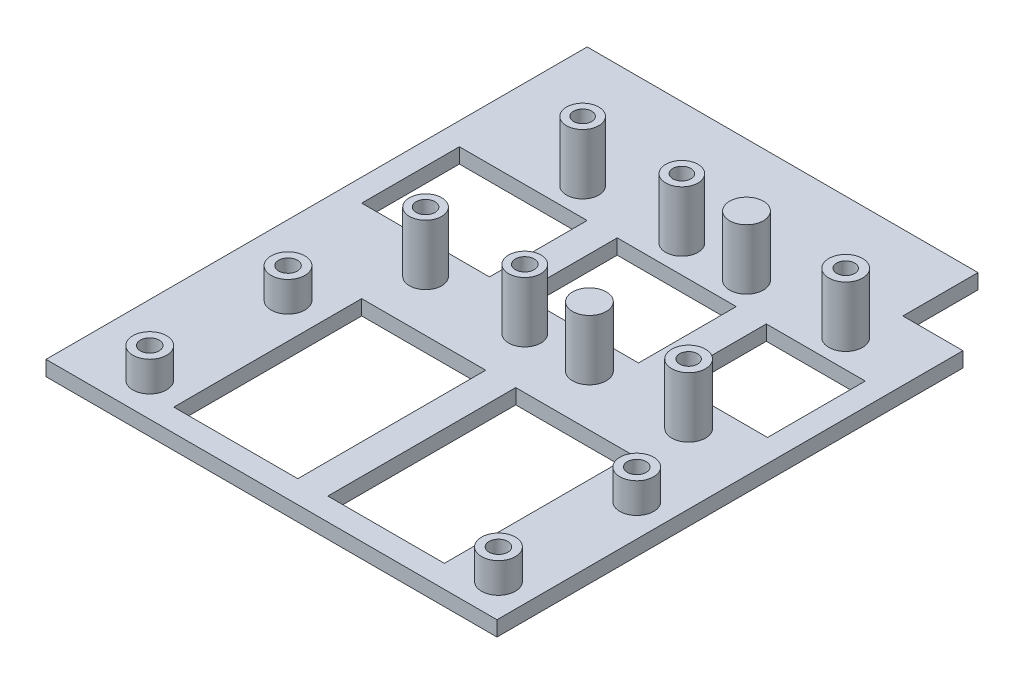
from build123d import *

# Parameters (mm, degrees)
SKETCH1_W               = 60
SKETCH1_H               = 72
BOTTOM_DEPTH            = 2
SKETCH2_R               = 2.25
PIN_LOCS_DEPTH          = 4
SKETCH5_R               = 1.25
PIN_HOLES_DEPTH         = 4
SKETCH3_R               = 2.25
SKETCH3_R_2             = 2.15
SENSOR_PINS_DEPTH       = 8
SKETCH6_R               = 1.25
SKETCH6_R_2             = 1.2
PIN_HOLES_SENSORS_DEPTH = 4
SKETCH4_W               = 8
SKETCH4_H               = 10
POWER_CABLE_DEPTH       = 2
SKETCH7_W               = 16.5
SKETCH7_H               = 25
SKETCH7_W_2             = 17
SKETCH7_H_2             = 13
SKETCH7_W_3             = 15.833991833
SKETCH7_W_4             = 13.166008167
SKETCH7_W_5             = 15.5
CUT_EXTRUDE1_DEPTH      = 2


with BuildPart() as part:
    # Sketch1 → Bottom (new body)
    with BuildSketch(Plane(origin=(0, 0, 0), x_dir=(1, 0, 0), z_dir=(0, 1, 0))):
        Rectangle(SKETCH1_W, SKETCH1_H)
    extrude(amount=BOTTOM_DEPTH)

    # Sketch2 → Pin Locs (add)
    with BuildSketch(Plane(origin=(0, 2, 0), x_dir=(1, 0, 0), z_dir=(0, 1, 0))):
        with Locations(Location((25.7, -13.1, 0), (0, 0, 90))):
            Circle(SKETCH2_R)
        with Locations(Location((-20.7, -13.1, 0), (0, 0, 270))):
            Circle(SKETCH2_R)
        with Locations(Location((25.7, -31.5, 0), (0, 0, 270))):
            Circle(SKETCH2_R)
        with Locations(Location((-20.7, -31.5, 0), (0, 0, 90))):
            Circle(SKETCH2_R)
    extrude(amount=PIN_LOCS_DEPTH)

    # Sketch5 → Pin Holes (cut)
    with BuildSketch(Plane(origin=(0, 6, 0), x_dir=(1, 0, 0), z_dir=(0, 1, 0))):
        with Locations(Location((-20.7, -31.5, 0), (0, 0, 270))):
            Circle(SKETCH5_R)
        with Locations(Location((-20.7, -13.1, 0), (0, 0, 270))):
            Circle(SKETCH5_R)
        with Locations(Location((25.7, -13.1, 0), (0, 0, 270))):
            Circle(SKETCH5_R)
        with Locations(Location((25.7, -31.5, 0), (0, 0, 270))):
            Circle(SKETCH5_R)
    extrude(amount=-PIN_HOLES_DEPTH, mode=Mode.SUBTRACT)

    # Sketch3 → Sensor Pins (add)
    with BuildSketch(Plane(origin=(0, 2, 0), x_dir=(1, 0, 0), z_dir=(0, 1, 0))):
        with Locations(Location((20.7, 19.7, 0), (0, 0, 270))):
            Circle(SKETCH3_R)
        with Locations(Location((20.7, -1.2, 0), (0, 0, 90))):
            Circle(SKETCH3_R)
        with Locations(Location((7.5, -1.2, 0), (0, 0, 270))):
            Circle(SKETCH3_R)
        with Locations(Location((7.5, 19.7, 0), (0, 0, 90))):
            Circle(SKETCH3_R)
        with Locations(Location((-1.1, 19.7, 0), (0, 0, 270))):
            Circle(SKETCH3_R_2)
        with Locations(Location((-1.1, -1.2, 0), (0, 0, 90))):
            Circle(SKETCH3_R_2)
        with Locations(Location((-14.3, -1.2, 0), (0, 0, 270))):
            Circle(SKETCH3_R_2)
        with Locations(Location((-14.3, 19.7, 0), (0, 0, 90))):
            Circle(SKETCH3_R_2)
    extrude(amount=SENSOR_PINS_DEPTH)

    # Sketch6 → Pin Holes Sensors (cut)
    with BuildSketch(Plane(origin=(0, 10, 0), x_dir=(1, 0, 0), z_dir=(0, 1, 0))):
        with Locations(Location((-14.3, -1.2, 0), (0, 0, 270))):
            Circle(SKETCH6_R)
        with Locations(Location((-1.1, -1.2, 0), (0, 0, 270))):
            Circle(SKETCH6_R)
        with Locations(Location((-1.1, 19.7, 0), (0, 0, 270))):
            Circle(SKETCH6_R_2)
        with Locations(Location((-14.3, 19.7, 0), (0, 0, 270))):
            Circle(SKETCH6_R_2)
        with Locations(Location((20.7, -1.2, 0), (0, 0, 270))):
            Circle(SKETCH6_R_2)
        with Locations(Location((20.7, 19.7, 0), (0, 0, 270))):
            Circle(SKETCH6_R_2)
    extrude(amount=-PIN_HOLES_SENSORS_DEPTH, mode=Mode.SUBTRACT)

    # Sketch4 → Power Cable (cut)
    with BuildSketch(Plane(origin=(0, 2, 0), x_dir=(1, 0, 0), z_dir=(0, 1, 0))):
        with Locations((26, 31)):
            Rectangle(SKETCH4_W, SKETCH4_H)
    extrude(amount=-POWER_CABLE_DEPTH, mode=Mode.SUBTRACT)

    # Sketch7 → Cut-Extrude1 (cut)
    with BuildSketch(Plane(origin=(0, 2, 0), x_dir=(1, 0, 0), z_dir=(0, 1, 0))):
        with Locations((-7.75, -20.5)):
            Rectangle(SKETCH7_W, SKETCH7_H)
        with Locations((-18.5, 9.5)):
            Rectangle(SKETCH7_W_2, SKETCH7_H_2)
        with Locations((1.916995917, 9.5)):
            Rectangle(SKETCH7_W_3, SKETCH7_H_2)
        with Locations((20.416995916, 9.5)):
            Rectangle(SKETCH7_W_4, SKETCH7_H_2)
        with Locations((12.25, -20.5)):
            Rectangle(SKETCH7_W_5, SKETCH7_H)
    extrude(amount=-CUT_EXTRUDE1_DEPTH, mode=Mode.SUBTRACT)


solid = part.part
